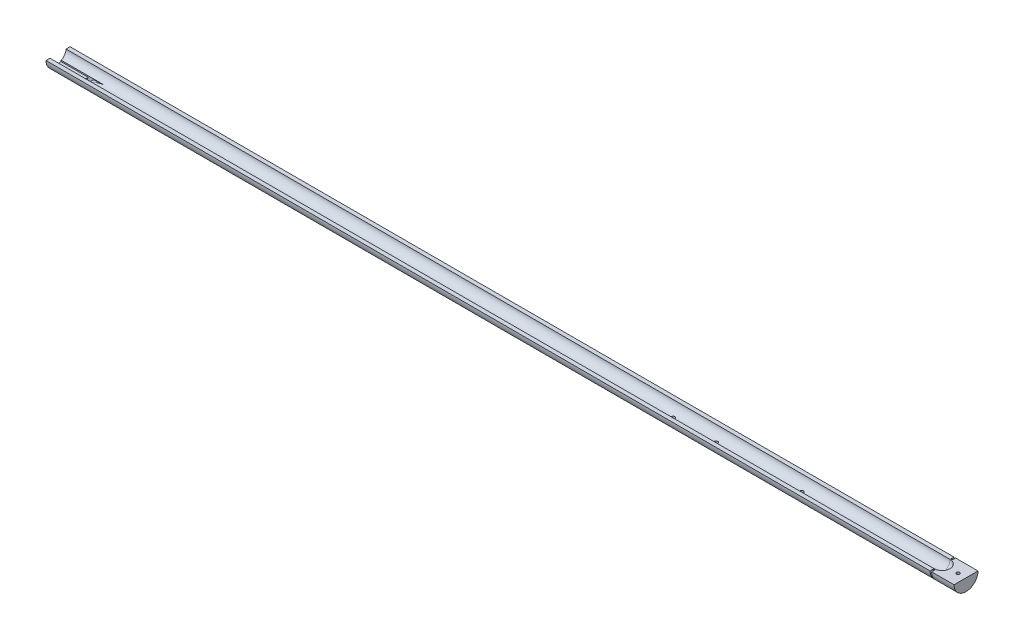
from build123d import *

# Parameters (mm, degrees)
SKETCH1_W                   = 1803.4
SKETCH1_H                   = 57.15
WOOD_BLOCK_DEPTH            = 28.575
FIPPLE_DEPTH                = 6.35
SKETCH3_R                   = 3.81
FINGER_HOLES_DEPTH          = 1805.531577204
FIPPLE_INSIDE_CHAMFER_DEPTH = 6.35
SKETCH8_W                   = 12.7
SKETCH8_H                   = 6.694937241
FLUE_DEPTH                  = 58.42
SKETCH10_R                  = 3.175
DOWEL_PIN_HOLE_DEPTH        = 15.24
SKETCH6_OUTSIDE_W           = 420.056
SKETCH6_OUTSIDE_H           = 391.481
SKETCH6_OUTSIDE_R           = 23.8125
OUTSIDE_DIAMETER_DEPTH      = 1805.531577205
SKETCH11_W                  = 3.175
SKETCH11_H                  = 6.35


with BuildPart() as part:
    # Sketch1 → wood block (new body)
    with BuildSketch(Plane(origin=(0, 0, 0), x_dir=(1, 0, 0), z_dir=(0, 1, 0))):
        with Locations((901.7, 28.575)):
            Rectangle(SKETCH1_W, SKETCH1_H)
    extrude(amount=WOOD_BLOCK_DEPTH)

    # Sketch2 → Inner Bore (revolve, cut)
    with BuildSketch(Plane.XY.offset(-28.575)):
        with BuildLine():
            Line((1771.65, 28.575), (-15.875, 28.575))
            ThreePointArc((-15.875, 28.575), (-11.225320151, 17.349679849), (0, 12.7))
            Line((0, 12.7), (1755.775, 12.7))
            ThreePointArc((1755.775, 12.7), (1767.000320151, 17.349679849), (1771.65, 28.575))
        make_face()
    revolve(axis=Axis((1771.65, 28.575, -28.575), (-1, 0, 0)), mode=Mode.SUBTRACT)

    # Sketch5 → fipple (cut, symmetric)
    with BuildSketch(Plane.XY.offset(-28.575)):
        Polygon((53.975, 28.575), (53.975, 12.1285), (48.951210809, 0), (53.975, 0), (64.135, 0), (97.457779882, 0), (64.135, 12.1285), (64.135, 28.575), align=None)
    extrude(amount=FIPPLE_DEPTH, both=True, mode=Mode.SUBTRACT)

    # Sketch3 → finger holes (cut, through all)
    with BuildSketch(Plane(origin=(0, 0, 0), x_dir=(1, 0, 0), z_dir=(0, 1, 0))):
        with Locations(Location((1476.629, 28.575, 0), (0, 0, 90))):
            Circle(SKETCH3_R)
        with Locations(Location((1306.449, 28.575, 0), (0, 0, 90))):
            Circle(SKETCH3_R)
        with Locations(Location((1221.359, 28.575, 0), (0, 0, 90))):
            Circle(SKETCH3_R)
    extrude(amount=FINGER_HOLES_DEPTH, mode=Mode.SUBTRACT)

    # Sketch9 → fipple inside chamfer (cut, symmetric)
    with BuildSketch(Plane.XY.offset(-28.575)):
        Polygon((64.135, 12.3825), (84.373651693, 14.153152588), (64.135, 16.801291368), align=None)
    extrude(amount=FIPPLE_INSIDE_CHAMFER_DEPTH, both=True, mode=Mode.SUBTRACT)

    # Sketch8 → flue (cut)
    with BuildSketch(Plane.ZY):
        with Locations((-28.575, 14.842545711)):
            Rectangle(SKETCH8_W, SKETCH8_H)
    extrude(amount=-FLUE_DEPTH, mode=Mode.SUBTRACT)

    # Sketch10 → dowel pin hole (cut)
    with BuildSketch(Plane(origin=(0, 28.575, 0), x_dir=(1, 0, 0), z_dir=(0, 1, 0))):
        with Locations(Location((1787.525, 28.575, 0), (0, 0, 270))):
            Circle(SKETCH10_R)
    extrude(amount=-DOWEL_PIN_HOLE_DEPTH, mode=Mode.SUBTRACT)

    # Sketch6 outside → outside diameter (cut, through all)
    with BuildSketch(Plane.ZY):
        with Locations((-28.575, 14.2875)):
            Rectangle(SKETCH6_OUTSIDE_W, SKETCH6_OUTSIDE_H)
        with Locations((-28.575, 28.575)):
            Circle(SKETCH6_OUTSIDE_R, mode=Mode.SUBTRACT)
    extrude(amount=-OUTSIDE_DIAMETER_DEPTH, mode=Mode.SUBTRACT)

    # Sketch11 → end length locator (revolve, cut)
    with BuildSketch(Plane(origin=(0, 28.575, 0), x_dir=(1, 0, 0), z_dir=(0, 1, 0))):
        with Locations((1757.3625, 7.9375)):
            Rectangle(SKETCH11_W, SKETCH11_H)
    revolve(axis=Axis((0, 28.575, -28.575), (1, 0, 0)), mode=Mode.SUBTRACT)


solid = part.part
